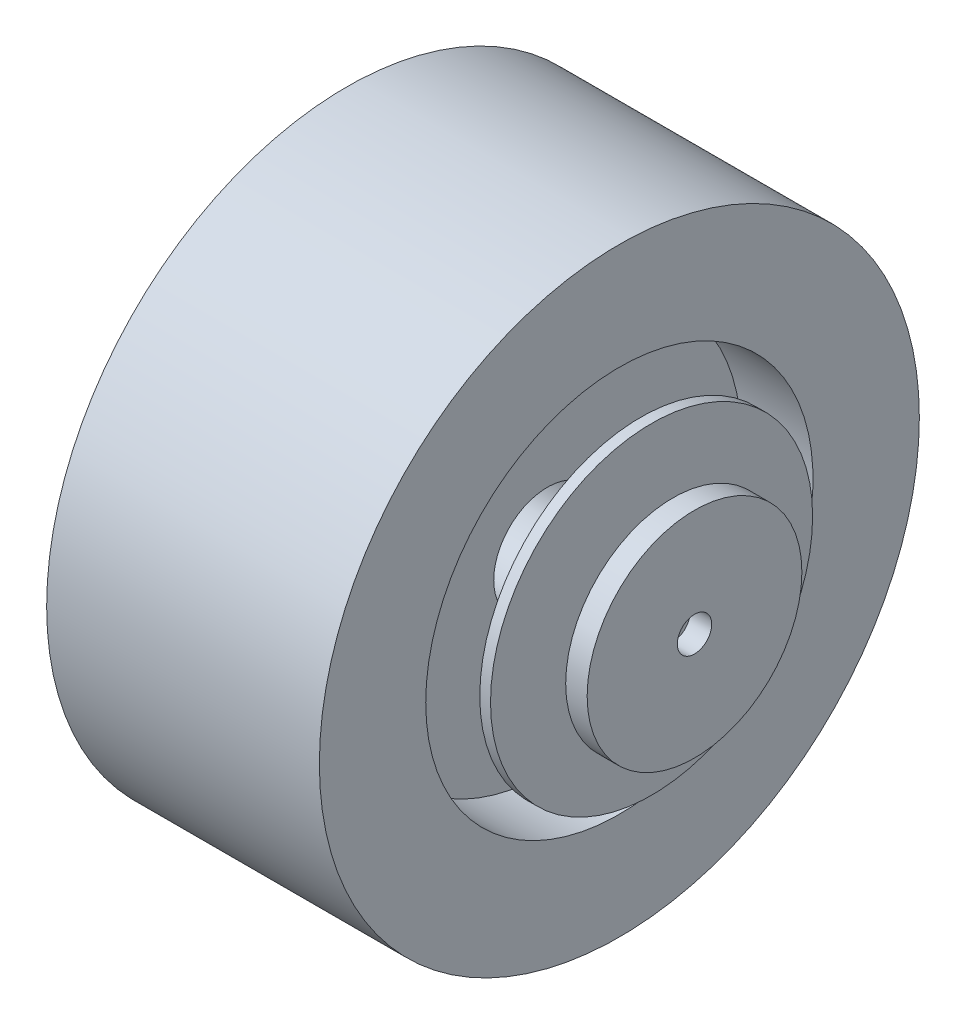
from build123d import *

# Parameters (mm, degrees)
BOSS_EXTRUDE1_START = 10
SKETCH2_R           = 75
BOSS_EXTRUDE1_DEPTH = 5
BOSS_EXTRUDE2_START = 10
SKETCH3_R           = 50
BOSS_EXTRUDE2_DEPTH = 10
SKETCH4_R           = 8
CUT_EXTRUDE1_DEPTH  = 256.492035101


with BuildPart() as part:
    # Sketch1 → Revolve1 (revolve)
    with BuildSketch(Plane.XY, mode=Mode.PRIVATE) as revolve1_sk:
        Polygon((0, -25), (0, -139.7), (-63.5, -139.7), (-63.5, -90.17), (-30, -90.17), (-30, -25), align=None)
    revolve1 = revolve(revolve1_sk.sketch.rotate(Axis((-62.857142857, 0, 0), (1, 0, 0)), 270), axis=Axis((-62.857142857, 0, 0), (1, 0, 0)))

    # Mirror1: Revolve1 across plane
    add(revolve1.mirror(Plane(origin=(0, 0, 0), x_dir=(0, 0, 1), z_dir=(1, 0, 0))))


with BuildPart() as body_2:
    # Sketch2 → Boss-Extrude1 (new body)
    with BuildSketch(Plane(origin=(63.5, 0, 0), x_dir=(0, 0, -1), z_dir=(1, 0, 0)).offset(BOSS_EXTRUDE1_START)):
        Circle(SKETCH2_R)
    extrude(amount=BOSS_EXTRUDE1_DEPTH)


with BuildPart() as body_3:
    # Sketch3 → Boss-Extrude2 (new body)
    with BuildSketch(Plane(origin=(78.5, 0, 0), x_dir=(0, 0, -1), z_dir=(1, 0, 0)).offset(BOSS_EXTRUDE2_START)):
        Circle(SKETCH3_R)
    extrude(amount=BOSS_EXTRUDE2_DEPTH)


with BuildPart() as cut_extrude1_tool:
    # Sketch4 → Cut-Extrude1 (new, through all)
    with BuildSketch(Plane(origin=(98.5, 0, 0), x_dir=(0, 0, -1), z_dir=(1, 0, 0))):
        Circle(SKETCH4_R)
    extrude(amount=-CUT_EXTRUDE1_DEPTH)


with BuildPart() as body_2_1:
    add(body_2.part)

    # Cut-Extrude1: cut by cut_extrude1_tool
    add(cut_extrude1_tool.part, mode=Mode.SUBTRACT)


with BuildPart() as body_3_1:
    add(body_3.part)

    # Cut-Extrude1: cut by cut_extrude1_tool
    add(cut_extrude1_tool.part, mode=Mode.SUBTRACT)


solid = Compound([part.part, body_2_1.part, body_3_1.part])
